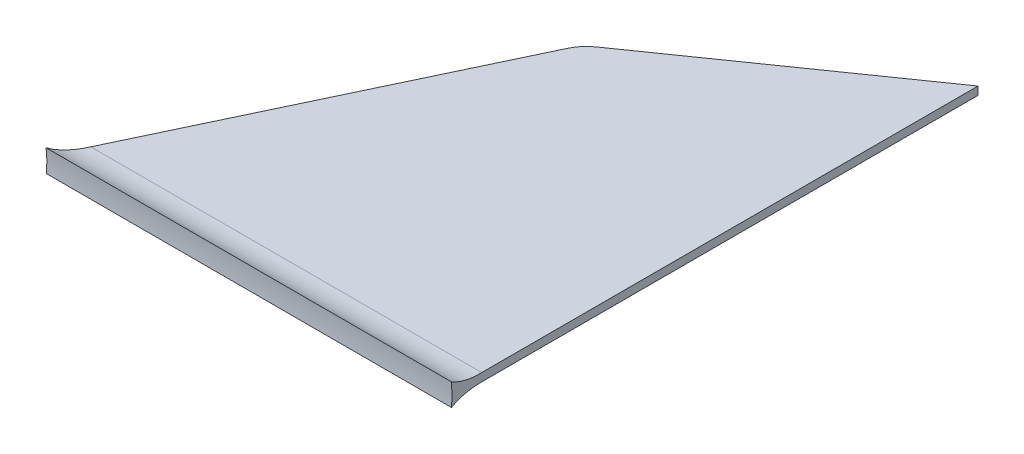
from build123d import *

# Parameters (mm, degrees)
RESSALTO_EXTRUS_O1_DEPTH      = 2
FILETE1_R                     = 10
RESSALTO_EXTRUS_O2_DEPTH      = 2
RESSALTO_EXTRUS_O2_DEPTH_BACK = 4
CORTE_EXTRUS_O1_DEPTH         = 106
ESBO_O5_R                     = 32.5
CORTE_EXTRUS_O2_DEPTH         = 106


with BuildPart() as part:
    # Esboço1 → Ressalto-extrusão1 (new body)
    with BuildSketch(Plane(origin=(0, 0, 0), x_dir=(1, 0, 0), z_dir=(0, 1, 0))):
        Polygon((0, 0), (100.1, 0), (100.1, 130.2), (42.5645027, 90), align=None)
    extrude(amount=RESSALTO_EXTRUS_O1_DEPTH)

    # Filete1
    filete1_edges = [part.edges().sort_by_distance(p)[0] for p in [
        (42.5645027, 1, -90),
    ]]
    fillet(filete1_edges, radius=FILETE1_R)

    # Esboço2 → Ressalto-extrusão2 (add, two sides: drawn at the far end of the back side and taken through both)
    with BuildSketch(Plane(origin=(0, 0, 0), x_dir=(-1, 0, 0), z_dir=(0, -1, 0)).offset(-RESSALTO_EXTRUS_O2_DEPTH_BACK)):
        Polygon((-100.1, 0), (-100.1, 7.845993173), (-3.710675529, 7.845993173), (0, 0), align=None)
    extrude(amount=RESSALTO_EXTRUS_O2_DEPTH + RESSALTO_EXTRUS_O2_DEPTH_BACK)

    # Esboço4 → Corte-extrusão1 (cut)
    with BuildSketch(Plane(origin=(100.1, 0, 0), x_dir=(0, 0, -1), z_dir=(1, 0, 0))):
        with BuildLine():
            Line((0, 4), (7.845993173, 4))
            Line((7.845993173, 4), (7.845993173, 2))
            add(Edge.make_bspline(
                [(7.845993173, 2), (3.140345255, 1.903943557), (0, 4)],
                knots=[0, 0, 0, 1, 1, 1], degree=2))
        make_face()
        with BuildLine():
            Line((7.845993173, 0), (7.845993173, -2))
            Line((7.845993173, -2), (0, -2))
            add(Edge.make_bspline(
                [(7.845993173, 0), (3.106908611, 0.009053077), (0, -2)],
                knots=[0, 0, 0, 1, 1, 1], degree=2))
        make_face()
    extrude(amount=-CORTE_EXTRUS_O1_DEPTH, mode=Mode.SUBTRACT)

    # Esboço5 → Corte-extrusão2 (cut)
    with BuildSketch(Plane(origin=(100.1, 0, 0), x_dir=(0, 0, -1), z_dir=(1, 0, 0))):
        with Locations((-32, 0.73240575)):
            Circle(ESBO_O5_R)
    extrude(amount=-CORTE_EXTRUS_O2_DEPTH, mode=Mode.SUBTRACT)


solid = part.part
